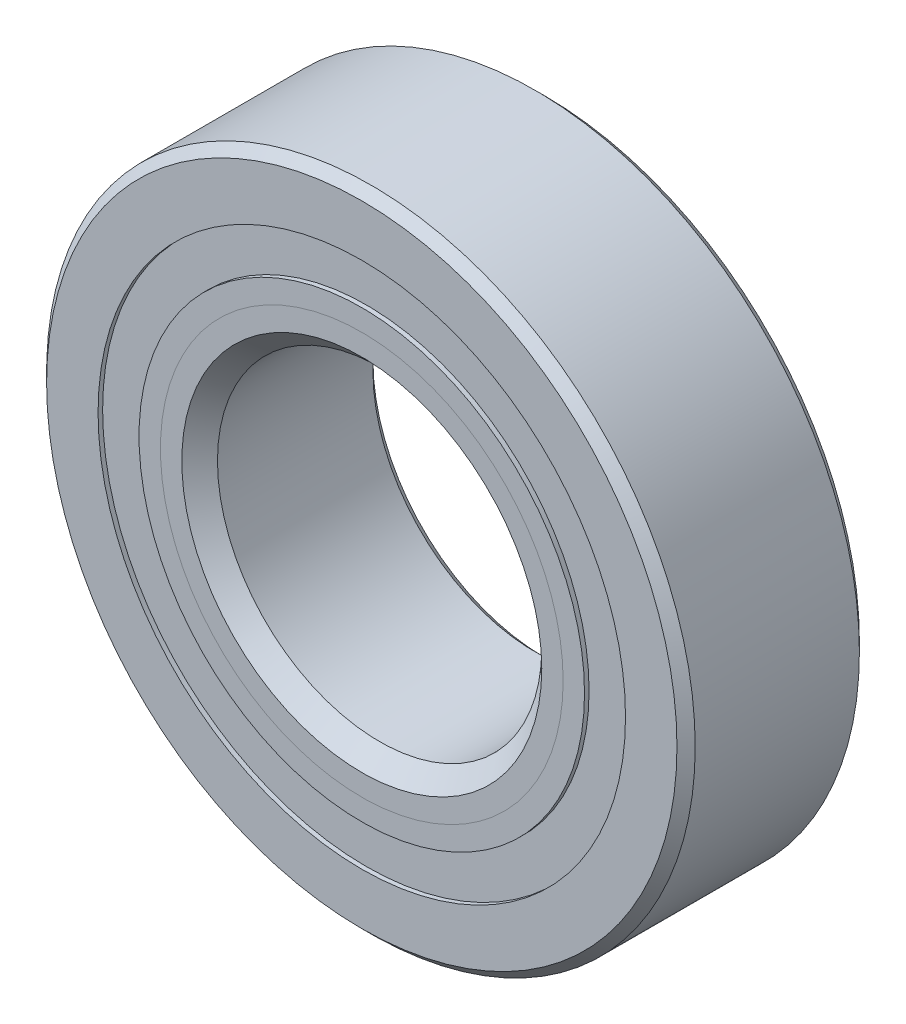
from build123d import *

# Parameters (mm, degrees)
CIRPATTERN1_COUNT = 12
SKETCH5_W         = 3.228968702
SKETCH5_H         = 3.20989011


with BuildPart() as part:
    # Sketch1 → Revolve1 (revolve)
    with BuildSketch(Plane(origin=(0, 0, 0), x_dir=(0, 0, -1), z_dir=(1, 0, 0))):
        with BuildLine():
            Line((6.429375, 25.4), (-6.429375, 25.4))
            Line((-6.429375, 25.4), (-7.14375, 24.685625))
            Line((-7.14375, 24.685625), (-7.14375, 20.654945055))
            Line((-7.14375, 20.654945055), (-3.175, 20.654945055))
            ThreePointArc((-3.175, 20.654945055), (0, 22.607593798), (3.175, 20.654945055))
            Line((3.175, 20.654945055), (7.14375, 20.654945055))
            Line((7.14375, 20.654945055), (7.14375, 24.685625))
            Line((7.14375, 24.685625), (6.429375, 25.4))
        make_face()
    revolve(axis=Axis((0, 0, 7.14375), (0, 0, -1)))


with BuildPart() as body_2:
    # Sketch2 → Revolve2 (revolve)
    with BuildSketch(Plane(origin=(0, 0, 0), x_dir=(0, 0, -1), z_dir=(1, 0, 0))):
        with BuildLine():
            Line((-7.14375, 17.445054945), (-3.175, 17.445054945))
            ThreePointArc((-3.175, 17.445054945), (-1.863696737, 16.019635649), (0, 15.492406202))
            Line((0, 15.492406202), (0, 14.096203101))
            Line((0, 14.096203101), (-5.469324078, 14.096203101))
            Line((-5.469324078, 14.096203101), (-7.14375, 15.770629023))
            Line((-7.14375, 15.770629023), (-7.14375, 17.445054945))
        make_face()
    revolve(axis=Axis((0, 0, 7.14375), (0, 0, -1)))


with BuildPart() as body_3:
    # Sketch3 → Revolve3 (revolve)
    with BuildSketch(Plane(origin=(0, 0, 0), x_dir=(0, 0, -1), z_dir=(1, 0, 0))):
        with BuildLine():
            Line((-7.14375, 15.770629023), (-5.469324078, 14.096203101))
            Line((-5.469324078, 14.096203101), (0, 14.096203101))
            Line((0, 14.096203101), (0, 15.492406202))
            ThreePointArc((0, 15.492406202), (1.863696737, 16.019635649), (3.175, 17.445054945))
            Line((3.175, 17.445054945), (7.14375, 17.445054945))
            Line((7.14375, 17.445054945), (7.14375, 13.414375))
            Line((7.14375, 13.414375), (6.429375, 12.7))
            Line((6.429375, 12.7), (-5.747546899, 12.7))
            Line((-5.747546899, 12.7), (-7.14375, 14.096203101))
            Line((-7.14375, 14.096203101), (-7.14375, 15.770629023))
        make_face()
    revolve(axis=Axis((0, 0, 7.14375), (0, 0, -1)))


with BuildPart() as body_4:
    # Sketch4 → Revolve4 (revolve)
    with BuildSketch(Plane(origin=(0, 0, 0), x_dir=(0, 0, -1), z_dir=(1, 0, 0))):
        with BuildLine():
            Line((-3.557593798, 19.05), (3.557593798, 19.05))
            ThreePointArc((3.557593798, 19.05), (0, 22.607593798), (-3.557593798, 19.05))
        make_face()
    revolve(axis=Axis((0, 19.05, 3.557593798), (0, 0, -1)))


with BuildPart() as cirpattern1_1:
    # CirPattern1: pattern copy
    add(body_4.part.rotate(Axis((0, 0, -7.14375), (0, 0, 1)), 1 * 360 / CIRPATTERN1_COUNT))


with BuildPart() as cirpattern1_2:
    # CirPattern1: pattern copy
    add(body_4.part.rotate(Axis((0, 0, -7.14375), (0, 0, 1)), 2 * 360 / CIRPATTERN1_COUNT))


with BuildPart() as cirpattern1_3:
    # CirPattern1: pattern copy
    add(body_4.part.rotate(Axis((0, 0, -7.14375), (0, 0, 1)), 3 * 360 / CIRPATTERN1_COUNT))


with BuildPart() as cirpattern1_4:
    # CirPattern1: pattern copy
    add(body_4.part.rotate(Axis((0, 0, -7.14375), (0, 0, 1)), 4 * 360 / CIRPATTERN1_COUNT))


with BuildPart() as cirpattern1_5:
    # CirPattern1: pattern copy
    add(body_4.part.rotate(Axis((0, 0, -7.14375), (0, 0, 1)), 5 * 360 / CIRPATTERN1_COUNT))


with BuildPart() as cirpattern1_6:
    # CirPattern1: pattern copy
    add(body_4.part.rotate(Axis((0, 0, -7.14375), (0, 0, 1)), 6 * 360 / CIRPATTERN1_COUNT))


with BuildPart() as cirpattern1_7:
    # CirPattern1: pattern copy
    add(body_4.part.rotate(Axis((0, 0, -7.14375), (0, 0, 1)), 7 * 360 / CIRPATTERN1_COUNT))


with BuildPart() as cirpattern1_8:
    # CirPattern1: pattern copy
    add(body_4.part.rotate(Axis((0, 0, -7.14375), (0, 0, 1)), 8 * 360 / CIRPATTERN1_COUNT))


with BuildPart() as cirpattern1_9:
    # CirPattern1: pattern copy
    add(body_4.part.rotate(Axis((0, 0, -7.14375), (0, 0, 1)), 9 * 360 / CIRPATTERN1_COUNT))


with BuildPart() as cirpattern1_10:
    # CirPattern1: pattern copy
    add(body_4.part.rotate(Axis((0, 0, -7.14375), (0, 0, 1)), 10 * 360 / CIRPATTERN1_COUNT))


with BuildPart() as cirpattern1_11:
    # CirPattern1: pattern copy
    add(body_4.part.rotate(Axis((0, 0, -7.14375), (0, 0, 1)), 11 * 360 / CIRPATTERN1_COUNT))


with BuildPart() as body_16:
    # Sketch5 → Revolve5 (revolve)
    with BuildSketch(Plane(origin=(0, 0, 0), x_dir=(0, 0, -1), z_dir=(1, 0, 0))):
        with Locations((-5.172078149, 19.05)):
            Rectangle(SKETCH5_W, SKETCH5_H)
        with Locations((5.172078149, 19.05)):
            Rectangle(SKETCH5_W, SKETCH5_H)
    revolve(axis=Axis((0, 0, 7.14375), (0, 0, -1)))


solid = Compound([part.part, body_2.part, body_3.part, body_4.part, cirpattern1_1.part, cirpattern1_2.part, cirpattern1_3.part, cirpattern1_4.part, cirpattern1_5.part, cirpattern1_6.part, cirpattern1_7.part, cirpattern1_8.part, cirpattern1_9.part, cirpattern1_10.part, cirpattern1_11.part, body_16.part])
